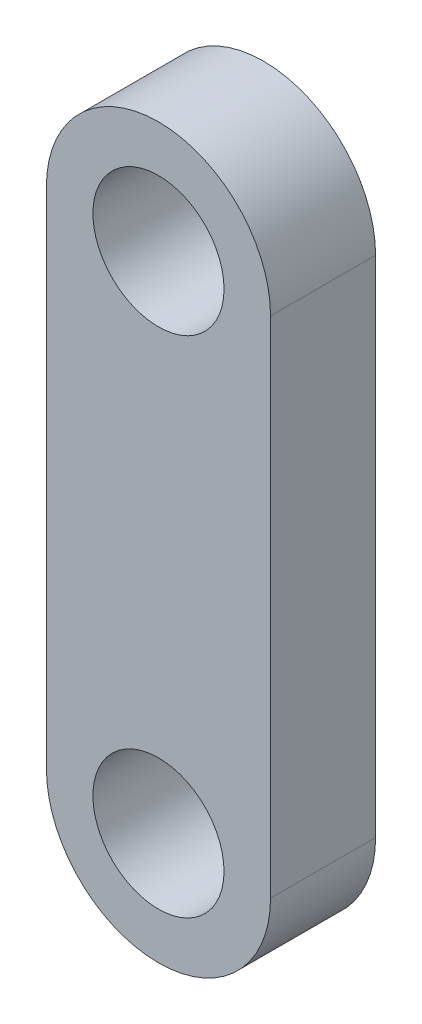
from build123d import *

# Parameters (mm, degrees)
SKETCH1_R           = 1.872
BOSS_EXTRUDE1_DEPTH = 3


with BuildPart() as part:
    # Sketch1 → Boss-Extrude1 (new body)
    with BuildSketch(Plane.XY):
        with BuildLine():
            Line((-3.2, 14.4), (-3.2, 0))
            ThreePointArc((-3.2, 0), (0, -3.2), (3.2, 0))
            Line((3.2, 0), (3.2, 14.4))
            ThreePointArc((3.2, 14.4), (0, 17.6), (-3.2, 14.4))
        make_face()
        Circle(SKETCH1_R, mode=Mode.SUBTRACT)
        with Locations((0, 14.4)):
            Circle(SKETCH1_R, mode=Mode.SUBTRACT)
    extrude(amount=BOSS_EXTRUDE1_DEPTH)


solid = part.part
